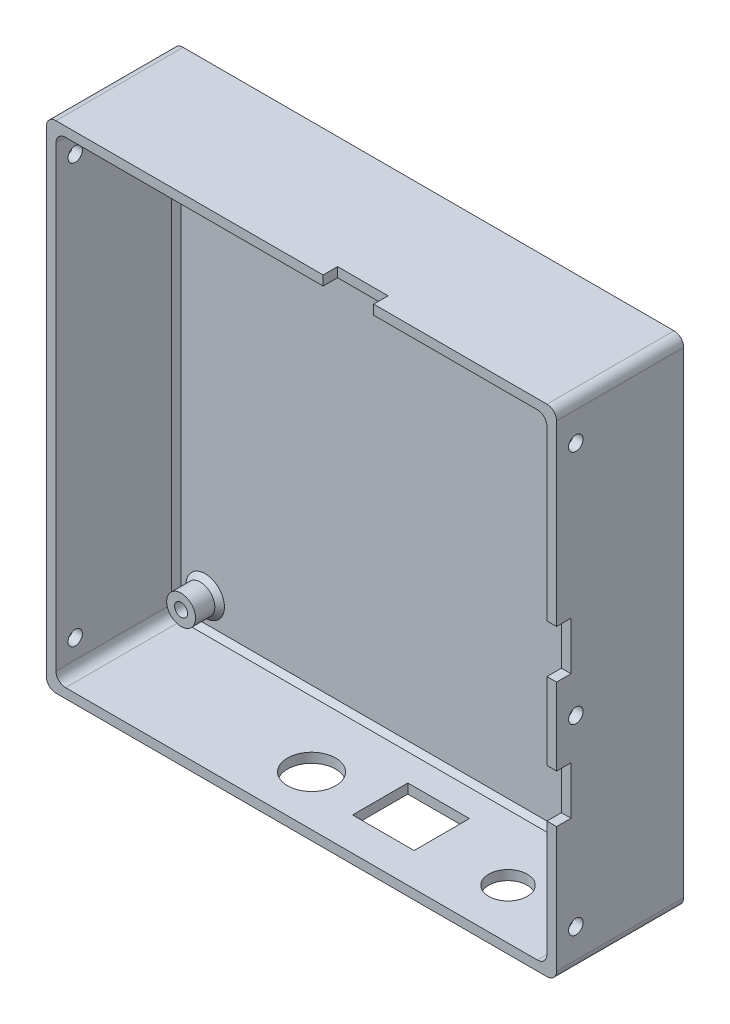
from build123d import *

# Parameters (mm, degrees)
SKETCH_1_W          = 106
SKETCH_1_H          = 103
SKETCH_1_W_2        = 102
SKETCH_1_H_2        = 99
EXTRUDE_1_DEPTH     = 25
SKETCH_2_W          = 106
SKETCH_2_H          = 103
EXTRUDE_2_DEPTH     = 1.4
SKETCH_3_R          = 3
SKETCH_3_R_2        = 1.35
EXTRUDE_3_DEPTH     = 5
SKETCH_4_W          = 12.8
SKETCH_4_H          = 11.5
CUT_EXTRUDE_1_DEPTH = 101
FILLET_1_R          = 2
CHAMFER_1_SIZE      = 1
SKETCH_5_R          = 4
SKETCH_5_R_2        = 5
CUT_EXTRUDE_2_DEPTH = 2
SKETCH_6_W          = 3
SKETCH_6_H          = 10
CUT_EXTRUDE_3_DEPTH = 2
SKETCH_8_R          = 1.5
CUT_EXTRUDE_4_DEPTH = 121.470950855
SKETCH_9_R          = 1.5
CUT_EXTRUDE_5_DEPTH = 2
SKETCH_10_W         = 10.5
SKETCH_10_H         = 3
CUT_EXTRUDE_6_DEPTH = 2


with BuildPart() as part:
    # Эскиз1 → Бобышка-Вытянуть1 (new body)
    with BuildSketch(Plane.XY):
        Rectangle(SKETCH_1_W, SKETCH_1_H)
        Rectangle(SKETCH_1_W_2, SKETCH_1_H_2, mode=Mode.SUBTRACT)
    extrude(amount=EXTRUDE_1_DEPTH)

    # Эскиз2 → Бобышка-Вытянуть2 (add)
    with BuildSketch(Plane(origin=(0, 0, 0), x_dir=(-1, 0, 0), z_dir=(0, 0, -1))):
        Rectangle(SKETCH_2_W, SKETCH_2_H)
    extrude(amount=EXTRUDE_2_DEPTH)

    # Эскиз3 → Бобышка-Вытянуть3 (add)
    # profile 1 of 4: a face of its own
    with BuildSketch(Plane.XY):
        with Locations(Location((-45, 39.5, 0), (0, 0, 180))):
            Circle(SKETCH_3_R)
        with Locations((-45, 39.5)):
            Circle(SKETCH_3_R_2, mode=Mode.SUBTRACT)
    # profile 2 of 4: a face of its own
    with BuildSketch(Plane.XY):
        with Locations(Location((45, 39.5, 0), (0, 0, 180))):
            Circle(SKETCH_3_R)
        with Locations((45, 39.5)):
            Circle(SKETCH_3_R_2, mode=Mode.SUBTRACT)
    # profile 3 of 4: a face of its own
    with BuildSketch(Plane.XY):
        with Locations(Location((-45, -43.5, 0), (0, 0, 180))):
            Circle(SKETCH_3_R)
        with Locations((-45, -43.5)):
            Circle(SKETCH_3_R_2, mode=Mode.SUBTRACT)
    # profile 4 of 4: a face of its own
    with BuildSketch(Plane.XY):
        with Locations(Location((45, -43.5, 0), (0, 0, 180))):
            Circle(SKETCH_3_R)
        with Locations((45, -43.5)):
            Circle(SKETCH_3_R_2, mode=Mode.SUBTRACT)
    extrude(amount=EXTRUDE_3_DEPTH)

    # Эскиз4 → Вырез-Вытянуть1 (cut)
    with BuildSketch(Plane.XZ.offset(51.5)):
        with Locations((10.1, 12.35)):
            Rectangle(SKETCH_4_W, SKETCH_4_H)
    extrude(amount=-CUT_EXTRUDE_1_DEPTH, mode=Mode.SUBTRACT)

    # Скругление1
    fillet_1_edges = [part.edges().sort_by_distance(p)[0] for p in [
        (51, -49.5, 12.5),
        (51, 49.5, 12.5),
        (-51, 49.5, 12.5),
        (-51, -49.5, 12.5),
        (53, -51.5, 11.8),
        (-53, -51.5, 11.8),
        (-53, 51.5, 11.8),
        (53, 51.5, 11.8),
    ]]
    fillet(fillet_1_edges, radius=FILLET_1_R)

    # Фаска1
    chamfer_1_edges = [part.edges().sort_by_distance(p)[0] for p in [
        (-51, 0, 0),
        (0, -49.5, 0),
        (51, 0, 0),
        (0, 49.5, 0),
        (50.414213562, -48.914213562, 0),
        (50.414213562, 48.914213562, 0),
        (-50.414213562, 48.914213562, 0),
        (-50.414213562, -48.914213562, 0),
        (-42, 39.5, 0),
        (48, 39.5, 0),
        (-42, -43.5, 0),
        (48, -43.5, 0),
    ]]
    chamfer(chamfer_1_edges, length=CHAMFER_1_SIZE)

    # Эскиз5 → Вырез-Вытянуть2 (cut)
    with BuildSketch(Plane.XZ.offset(51.5)):
        with Locations(Location((32.5, 14.6, 0), (0, 0, 270))):
            Circle(SKETCH_5_R)
        with Locations(Location((-8.3, 14.6, 0), (0, 0, 270))):
            Circle(SKETCH_5_R_2)
    extrude(amount=-CUT_EXTRUDE_2_DEPTH, mode=Mode.SUBTRACT)

    # Эскиз6 → Вырез-Вытянуть3 (cut)
    with BuildSketch(Plane(origin=(53, 0, 0), x_dir=(0, 0, -1), z_dir=(1, 0, 0))):
        with Locations((-23.5, -18.5)):
            Rectangle(SKETCH_6_W, SKETCH_6_H)
        with Locations((-23.5, 7.5)):
            Rectangle(SKETCH_6_W, SKETCH_6_H)
    extrude(amount=-CUT_EXTRUDE_3_DEPTH, mode=Mode.SUBTRACT)

    # Эскиз8 → Вырез-Вытянуть4 (cut, through all)
    with BuildSketch(Plane(origin=(53, 0, 0), x_dir=(0, 0, -1), z_dir=(1, 0, 0))):
        with Locations((-21, 43.5)):
            Circle(SKETCH_8_R)
        with Locations((-21, -43.5)):
            Circle(SKETCH_8_R)
    extrude(amount=-CUT_EXTRUDE_4_DEPTH, mode=Mode.SUBTRACT)

    # Эскиз9 → Вырез-Вытянуть5 (cut)
    with BuildSketch(Plane(origin=(53, 0, 0), x_dir=(0, 0, -1), z_dir=(1, 0, 0))):
        with Locations((-21, -5.5)):
            Circle(SKETCH_9_R)
    extrude(amount=-CUT_EXTRUDE_5_DEPTH, mode=Mode.SUBTRACT)

    # Эскиз10 → Вырез-Вытянуть6 (cut)
    with BuildSketch(Plane(origin=(0, 51.5, 0), x_dir=(1, 0, 0), z_dir=(0, 1, 0))):
        with Locations((9.75, -23.5)):
            Rectangle(SKETCH_10_W, SKETCH_10_H)
    extrude(amount=-CUT_EXTRUDE_6_DEPTH, mode=Mode.SUBTRACT)


solid = part.part
